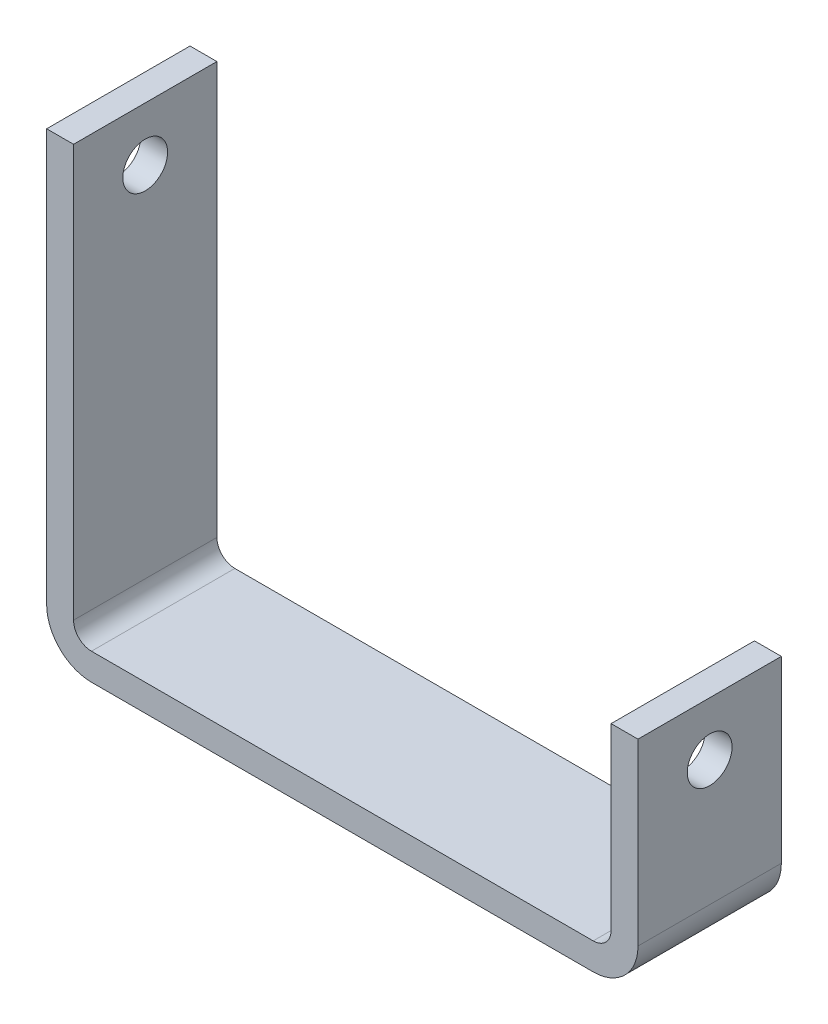
from build123d import *

# Parameters (mm, degrees)
BASE_EXTRUDE_THIN_DEPTH = 20
CUT_EXTRUDE1_REACH      = 187.74
SKETCH2_R               = 6.25
CUT_EXTRUDE2_REACH      = 207
SKETCH3_R               = 6.25


with BuildPart() as part:
    # Sketch1 → Base-Extrude-Thin (new, symmetric)
    with BuildSketch(Plane.XY):
        with BuildLine():
            Line((0, 120), (0, 5))
            ThreePointArc((0, 5), (1.464466094, 1.464466094), (5, 0))
            Line((5, 0), (145, 0))
            ThreePointArc((145, 0), (148.535533906, 1.464466094), (150, 5))
            Line((150, 5), (150, 55))
            Line((150, 55), (157.5, 55))
            Line((157.5, 55), (157.5, 5))
            ThreePointArc((157.5, 5), (153.838834765, -3.838834765), (145, -7.5))
            Line((145, -7.5), (5, -7.5))
            ThreePointArc((5, -7.5), (-3.838834765, -3.838834765), (-7.5, 5))
            Line((-7.5, 5), (-7.5, 120))
            Line((-7.5, 120), (0, 120))
        make_face()
    extrude(amount=BASE_EXTRUDE_THIN_DEPTH, both=True)

    # Sketch2 → Cut-Extrude1 (cut, up to next)
    with BuildSketch(Plane(origin=(0, 88.9, 0), x_dir=(0, -1, 0), z_dir=(-1, 0, 0)), mode=Mode.PRIVATE) as cut_extrude1_sk1:
        with Locations(Location((-16.1, 0, 0), (0, 0, 270))):
            Circle(SKETCH2_R)
    cut_extrude1_tool1 = extrude(cut_extrude1_sk1.sketch, amount=CUT_EXTRUDE1_REACH, mode=Mode.PRIVATE) & part.part
    add(cut_extrude1_tool1.solids().sort_by_distance((0, 105, 0))[0], mode=Mode.SUBTRACT)

    # Sketch3 → Cut-Extrude2 (cut, up to next)
    with BuildSketch(Plane(origin=(157.5, 0, 0), x_dir=(0, 0, -1), z_dir=(1, 0, 0)), mode=Mode.PRIVATE) as cut_extrude2_sk1:
        with Locations(Location((0, 40, 0), (0, 0, 90))):
            Circle(SKETCH3_R)
    cut_extrude2_tool1 = extrude(cut_extrude2_sk1.sketch, amount=-CUT_EXTRUDE2_REACH, mode=Mode.PRIVATE) & part.part
    add(cut_extrude2_tool1.solids().sort_by_distance((157.5, 40, 0))[0], mode=Mode.SUBTRACT)


solid = part.part
